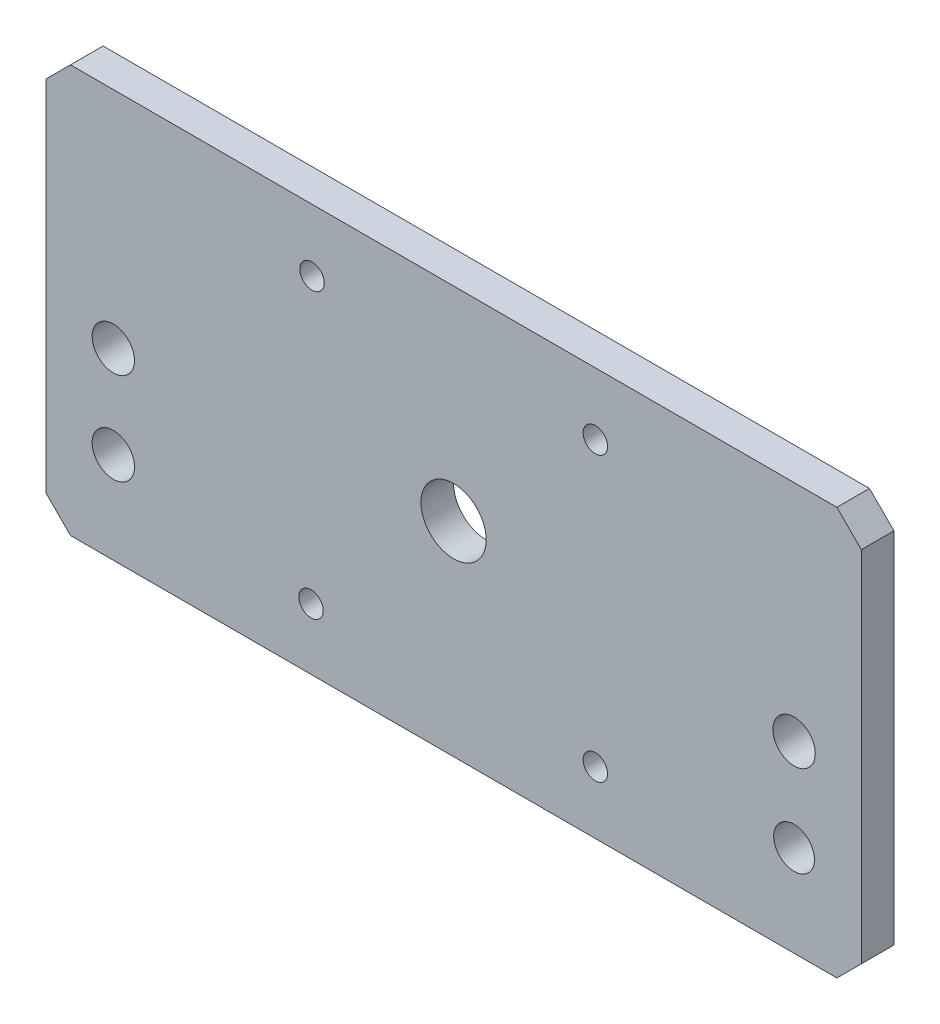
from build123d import *

# Parameters (mm, degrees)
ESQUISSE1_W             = 100
ESQUISSE1_H             = 50
BOSS_EXTRU_1_DEPTH      = 4
ESQUISSE2_R             = 1.5
ENL_V_MAT_EXTRU_1_DEPTH = 104.033974979
ESQUISSE3_R             = 4
ENL_V_MAT_EXTRU_2_DEPTH = 104.033974979
CONG_1_SIZE             = 3
ESQUISSE4_R             = 2.6
ESQUISSE4_R_2           = 2.49849628
ENL_V_MAT_EXTRU_3_DEPTH = 104.033974979


with BuildPart() as part:
    # Esquisse1 → Boss.-Extru.1 (new body)
    with BuildSketch(Plane.XY):
        with Locations((40, -25)):
            Rectangle(ESQUISSE1_W, ESQUISSE1_H)
    extrude(amount=BOSS_EXTRU_1_DEPTH)

    # Esquisse2 → Enlèv. mat.-Extru.1 (cut, through all)
    with BuildSketch(Plane(origin=(0, 0, 0), x_dir=(-1, 0, 0), z_dir=(0, 0, -1))):
        with Locations((-22.625, -7.625)):
            Circle(ESQUISSE2_R)
        with Locations((-57.375, -42.375)):
            Circle(ESQUISSE2_R)
        with Locations((-57.375, -7.625)):
            Circle(ESQUISSE2_R)
        with Locations((-22.5, -42.5)):
            Circle(ESQUISSE2_R)
    extrude(amount=-ENL_V_MAT_EXTRU_1_DEPTH, mode=Mode.SUBTRACT)

    # Esquisse3 → Enlèv. mat.-Extru.2 (cut, through all)
    with BuildSketch(Plane(origin=(0, 0, 0), x_dir=(-1, 0, 0), z_dir=(0, 0, -1))):
        with Locations((-39.984893454, -24.973718249)):
            Circle(ESQUISSE3_R)
    extrude(amount=-ENL_V_MAT_EXTRU_2_DEPTH, mode=Mode.SUBTRACT)

    # Congé1
    cong_1_edges = [part.edges().sort_by_distance(p)[0] for p in [
        (-10, 0, 2),
        (90, 0, 2),
        (90, -50, 2),
        (-10, -50, 2),
    ]]
    chamfer(cong_1_edges, length=CONG_1_SIZE)

    # Esquisse4 → Enlèv. mat.-Extru.3 (cut, through all)
    with BuildSketch(Plane.XY.offset(4)):
        with Locations((81.75, -27.5)):
            Circle(ESQUISSE4_R)
        with Locations((81.75, -38.8)):
            Circle(ESQUISSE4_R_2)
        with Locations((-1.75, -27.5)):
            Circle(ESQUISSE4_R)
        with Locations((-1.75, -38.8)):
            Circle(ESQUISSE4_R)
    extrude(amount=-ENL_V_MAT_EXTRU_3_DEPTH, mode=Mode.SUBTRACT)


solid = part.part
